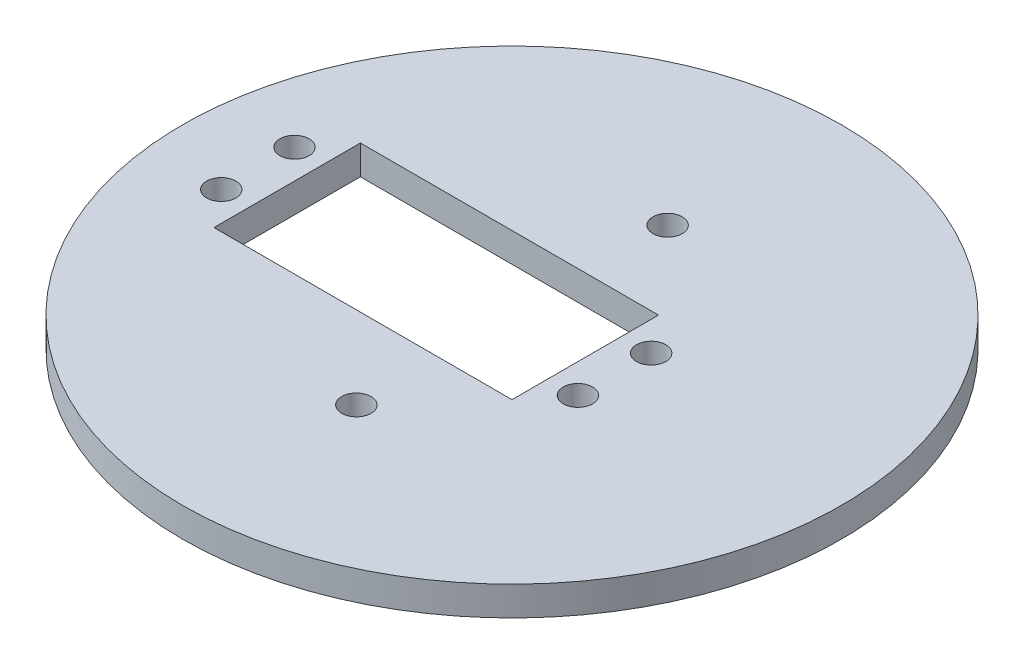
from build123d import *

# Parameters (mm, degrees)
SCHIZZO1_R                   = 45
ESTRUSIONE_ESTRUSIONE1_DEPTH = 2
CROQUIS1_R                   = 2
CROQUIS1_W                   = 40.7
CROQUIS1_H                   = 20
CORTAR_EXTRUIR1_DEPTH        = 10


with BuildPart() as part:
    # Schizzo1 → Estrusione-Estrusione1 (new, symmetric)
    with BuildSketch(Plane(origin=(0, 0, 0), x_dir=(1, 0, 0), z_dir=(0, 1, 0))):
        with Locations(Location((0, 0, 0), (0, 0, 270))):
            Circle(SCHIZZO1_R)
    extrude(amount=ESTRUSIONE_ESTRUSIONE1_DEPTH, both=True)

    # Croquis1 → Cortar-Extruir1 (cut)
    with BuildSketch(Plane(origin=(0, 2, 0), x_dir=(1, 0, 0), z_dir=(0, 1, 0))):
        with Locations(Location((-34.7, 5, 0), (0, 0, 270))):
            Circle(CROQUIS1_R)
        with Locations(Location((-34.7, -5, 0), (0, 0, 270))):
            Circle(CROQUIS1_R)
        with Locations(Location((0, -21.25, 0), (0, 0, 270))):
            Circle(CROQUIS1_R)
        with Locations(Location((0, 21.25, 0), (0, 0, 270))):
            Circle(CROQUIS1_R)
        with Locations(Location((14, 5, 0), (0, 0, 270))):
            Circle(CROQUIS1_R)
        with Locations(Location((14, -5, 0), (0, 0, 270))):
            Circle(CROQUIS1_R)
        with Locations((-10.35, 0)):
            Rectangle(CROQUIS1_W, CROQUIS1_H)
    extrude(amount=-CORTAR_EXTRUIR1_DEPTH, mode=Mode.SUBTRACT)


solid = part.part
